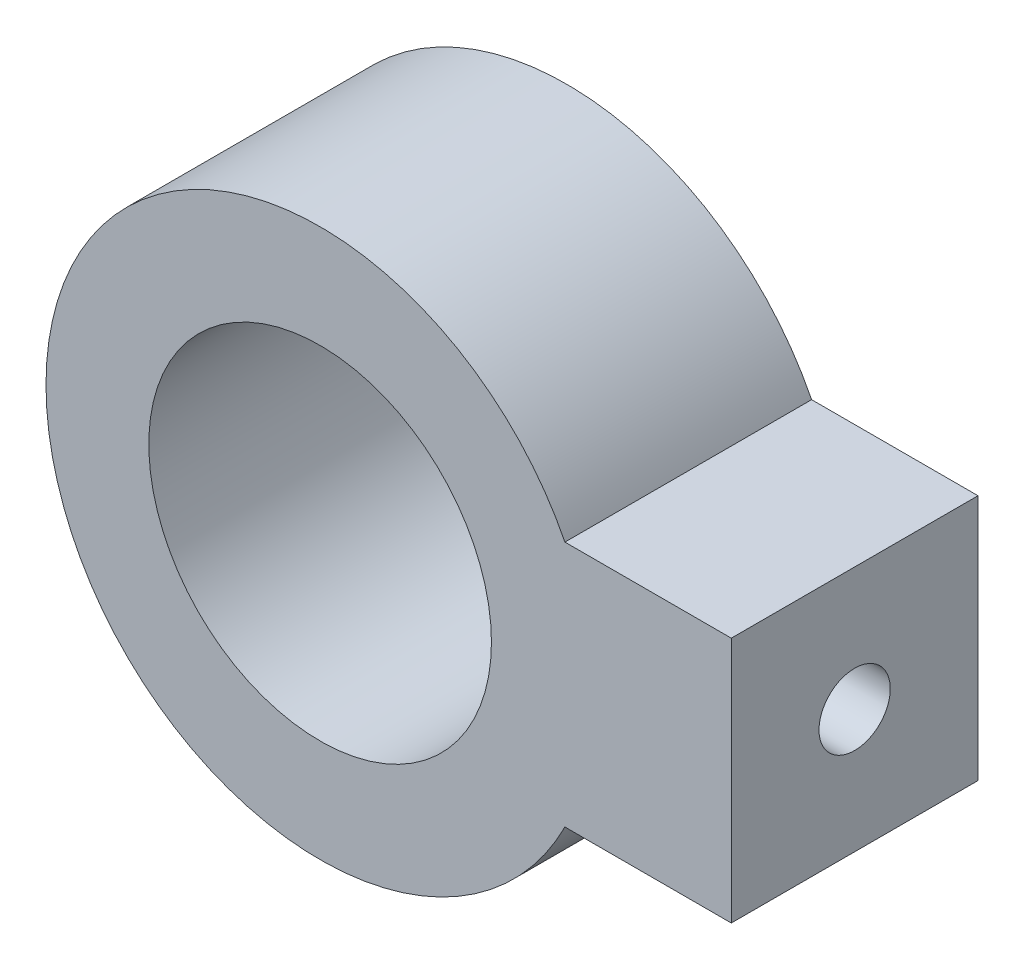
from build123d import *

# Parameters (mm, degrees)
SKETCH1_R                 = 10
SKETCH1_R_2               = 6.25
COLLAR_RING_DEPTH         = 9
SKETCH2_W                 = 7
SKETCH2_H                 = 9
SCREW_BOSS_DEPTH          = 9
SKETCH3_R                 = 1.3
M3_THUMB_SCREW_HOLE_DEPTH = 5.5


with BuildPart() as part:
    # Sketch1 → Collar_ring (new body)
    with BuildSketch(Plane.XY):
        Circle(SKETCH1_R)
        Circle(SKETCH1_R_2, mode=Mode.SUBTRACT)
    extrude(amount=COLLAR_RING_DEPTH)

    # Sketch2 → Screw_boss (add)
    with BuildSketch(Plane.XY):
        with Locations((11.5, 0)):
            Rectangle(SKETCH2_W, SKETCH2_H)
    extrude(amount=SCREW_BOSS_DEPTH)

    # Sketch3 → M3_thumb_screw_hole (cut, symmetric)
    with BuildSketch(Plane(origin=(10.5, 0, 0), x_dir=(0, 0, -1), z_dir=(1, 0, 0))):
        with Locations(Location((-4.5, 0, 0), (0, 0, 180))):
            Circle(SKETCH3_R)
    extrude(amount=M3_THUMB_SCREW_HOLE_DEPTH, both=True, mode=Mode.SUBTRACT)


solid = part.part
